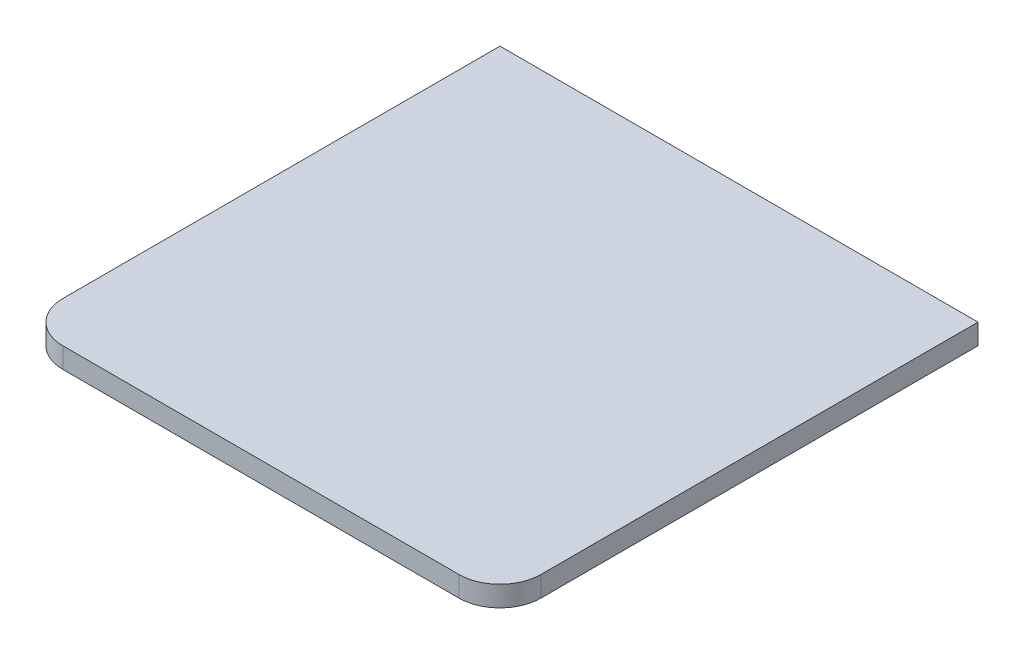
from build123d import *

# Parameters (mm, degrees)
SKETCH1_W           = 70
SKETCH1_H           = 70
BOSS_EXTRUDE1_DEPTH = 3
FILLET1_R           = 6


with BuildPart() as part:
    # Sketch1 → Boss-Extrude1 (new body)
    with BuildSketch(Plane(origin=(0, 0, 0), x_dir=(1, 0, 0), z_dir=(0, 1, 0))):
        Rectangle(SKETCH1_W, SKETCH1_H)
    extrude(amount=BOSS_EXTRUDE1_DEPTH)

    # Fillet1
    fillet1_edges = [part.edges().sort_by_distance(p)[0] for p in [
        (35, 1.5, 35),
        (-35, 1.5, 35),
    ]]
    fillet(fillet1_edges, radius=FILLET1_R)


solid = part.part
